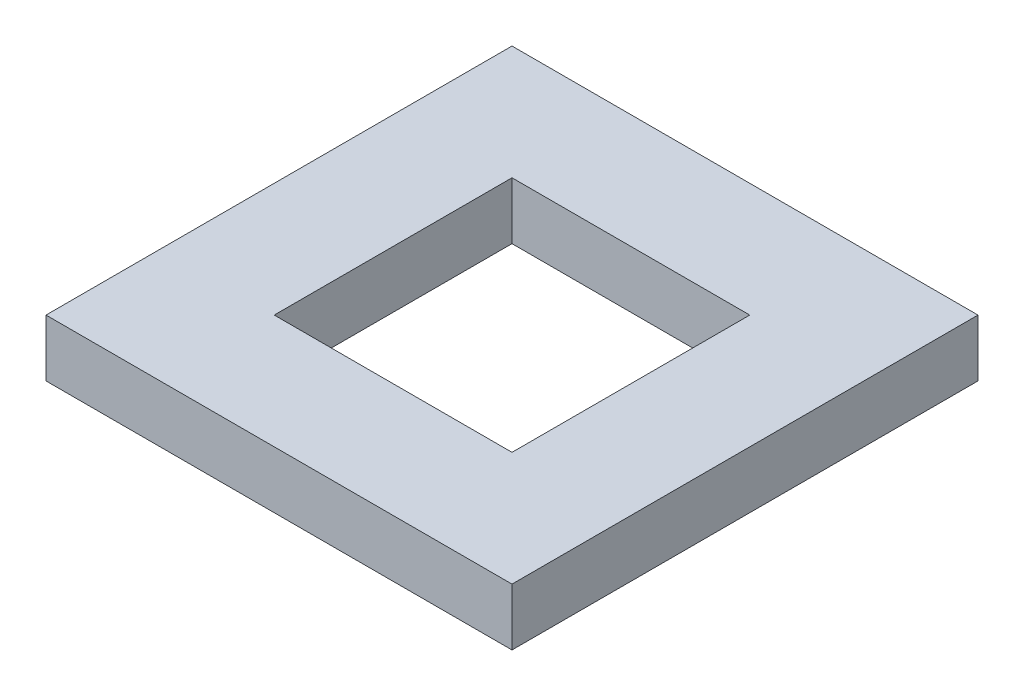
from build123d import *

# Parameters (mm, degrees)
SKETCH_2_W      = 24.5
SKETCH_2_H      = 24.5
SKETCH_2_W_2    = 12.5
SKETCH_2_H_2    = 12.5
EXTRUDE_1_DEPTH = 3


with BuildPart() as part:
    # Эскиз2 → Бобышка-Вытянуть1 (new body)
    with BuildSketch(Plane(origin=(0, 0, 0), x_dir=(1, 0, 0), z_dir=(0, 1, 0))):
        with Locations((12.25, 12.25)):
            Rectangle(SKETCH_2_W, SKETCH_2_H)
        with Locations((12.25, 12.25)):
            Rectangle(SKETCH_2_W_2, SKETCH_2_H_2, mode=Mode.SUBTRACT)
    extrude(amount=EXTRUDE_1_DEPTH)


solid = part.part
